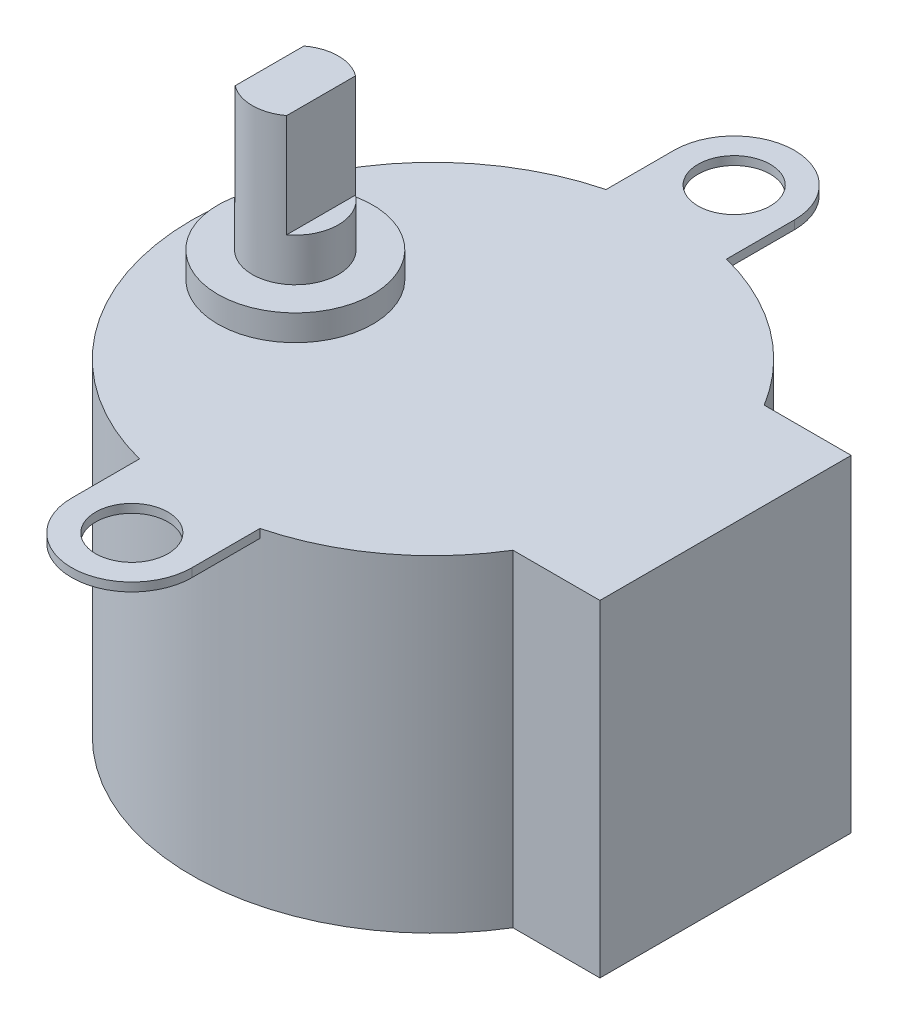
from build123d import *

# Parameters (mm, degrees)
BOSS_EXTRUDE1_DEPTH = 19
SKETCH3_R           = 2.1
BOSS_EXTRUDE2_DEPTH = 0.5
SKETCH4_R           = 4.5
BOSS_EXTRUDE3_DEPTH = 1.5
SKETCH5_R           = 2.5
BOSS_EXTRUDE4_DEPTH = 8.5
CUT_EXTRUDE1_START  = -6
CUT_EXTRUDE1_DEPTH  = 6


with BuildPart() as part:
    # Sketch1 → Boss-Extrude1 (new body)
    with BuildSketch(Plane(origin=(0, 0, 0), x_dir=(1, 0, 0), z_dir=(0, 1, 0))):
        with BuildLine():
            Line((11.94612908, 7.3), (17, 7.3))
            Line((17, 7.3), (17, -7.3))
            Line((17, -7.3), (11.94612908, -7.3))
            ThreePointArc((11.94612908, -7.3), (-14, 0), (11.94612908, 7.3))
        make_face()
    extrude(amount=BOSS_EXTRUDE1_DEPTH)

    # Sketch3 → Boss-Extrude2 (add)
    with BuildSketch(Plane(origin=(0, 19, 0), x_dir=(1, 0, 0), z_dir=(0, 1, 0))):
        with BuildLine():
            Line((3.5, 17.5), (3.5, -17.5))
            ThreePointArc((3.5, -17.5), (0, -21), (-3.5, -17.5))
            Line((-3.5, -17.5), (-3.5, 17.5))
            ThreePointArc((-3.5, 17.5), (0, 21), (3.5, 17.5))
        make_face()
        with Locations(Location((0, -17.5, 0), (0, 0, 270))):
            Circle(SKETCH3_R, mode=Mode.SUBTRACT)
        with Locations(Location((0, 17.5, 0), (0, 0, 270))):
            Circle(SKETCH3_R, mode=Mode.SUBTRACT)
    extrude(amount=-BOSS_EXTRUDE2_DEPTH)

    # Sketch4 → Boss-Extrude3 (add)
    with BuildSketch(Plane(origin=(0, 19, 0), x_dir=(1, 0, 0), z_dir=(0, 1, 0))):
        with Locations(Location((-8, 0, 0), (0, 0, 270))):
            Circle(SKETCH4_R)
    extrude(amount=BOSS_EXTRUDE3_DEPTH)

    # Sketch5 → Boss-Extrude4 (add)
    with BuildSketch(Plane(origin=(0, 20.5, 0), x_dir=(1, 0, 0), z_dir=(0, 1, 0))):
        with Locations(Location((-8, 0, 0), (0, 0, 270))):
            Circle(SKETCH5_R)
    extrude(amount=BOSS_EXTRUDE4_DEPTH)

    # Sketch6 → Cut-Extrude1 (cut)
    with BuildSketch(Plane(origin=(0, 29, 0), x_dir=(1, 0, 0), z_dir=(0, 1, 0)).offset(CUT_EXTRUDE1_START)):
        with BuildLine():
            Line((-9.5, 2), (-9.5, -2))
            ThreePointArc((-9.5, -2), (-10.5, 0), (-9.5, 2))
        make_face()
        with BuildLine():
            Line((-6.5, 2), (-6.5, -2))
            ThreePointArc((-6.5, -2), (-5.5, 0), (-6.5, 2))
        make_face()
    extrude(amount=CUT_EXTRUDE1_DEPTH, mode=Mode.SUBTRACT)


solid = part.part
